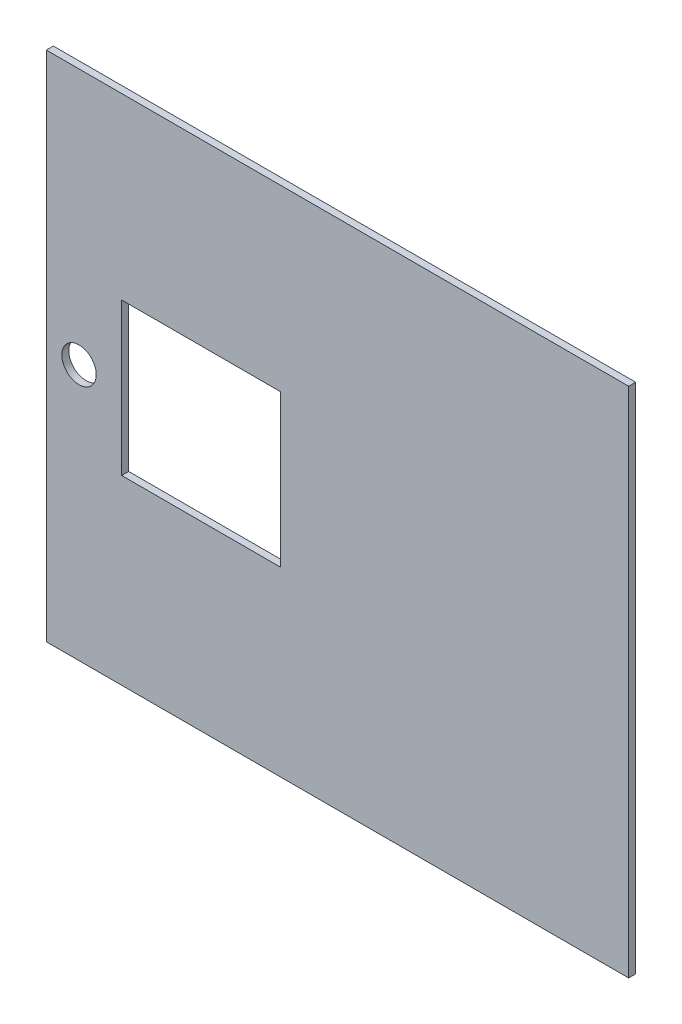
from build123d import *

# Parameters (mm, degrees)
SKETCH1_W           = 250
SKETCH1_H           = 220
BOSS_EXTRUDE1_DEPTH = 3
SKETCH2_W           = 68.242640687
SKETCH2_H           = 65.242640687
CUT_EXTRUDE1_DEPTH  = 3
SKETCH3_R           = 7.392015443
CUT_EXTRUDE2_DEPTH  = 10


with BuildPart() as part:
    # Sketch1 → Boss-Extrude1 (new body)
    with BuildSketch(Plane.XY):
        with Locations((28.200067517, 87.906622336)):
            Rectangle(SKETCH1_W, SKETCH1_H)
    extrude(amount=BOSS_EXTRUDE1_DEPTH)

    # Sketch2 → Cut-Extrude1 (cut)
    with BuildSketch(Plane(origin=(0, 0, 0), x_dir=(-1, 0, 0), z_dir=(0, 0, -1))):
        with Locations((30.322878983, 88.52794268)):
            Rectangle(SKETCH2_W, SKETCH2_H)
    extrude(amount=-CUT_EXTRUDE1_DEPTH, mode=Mode.SUBTRACT)

    # Sketch3 → Cut-Extrude2 (cut)
    with BuildSketch(Plane(origin=(0, 0, 0), x_dir=(-1, 0, 0), z_dir=(0, 0, -1))):
        with Locations((82.764080487, 87.906622336)):
            Circle(SKETCH3_R)
    extrude(amount=-CUT_EXTRUDE2_DEPTH, mode=Mode.SUBTRACT)


solid = part.part
